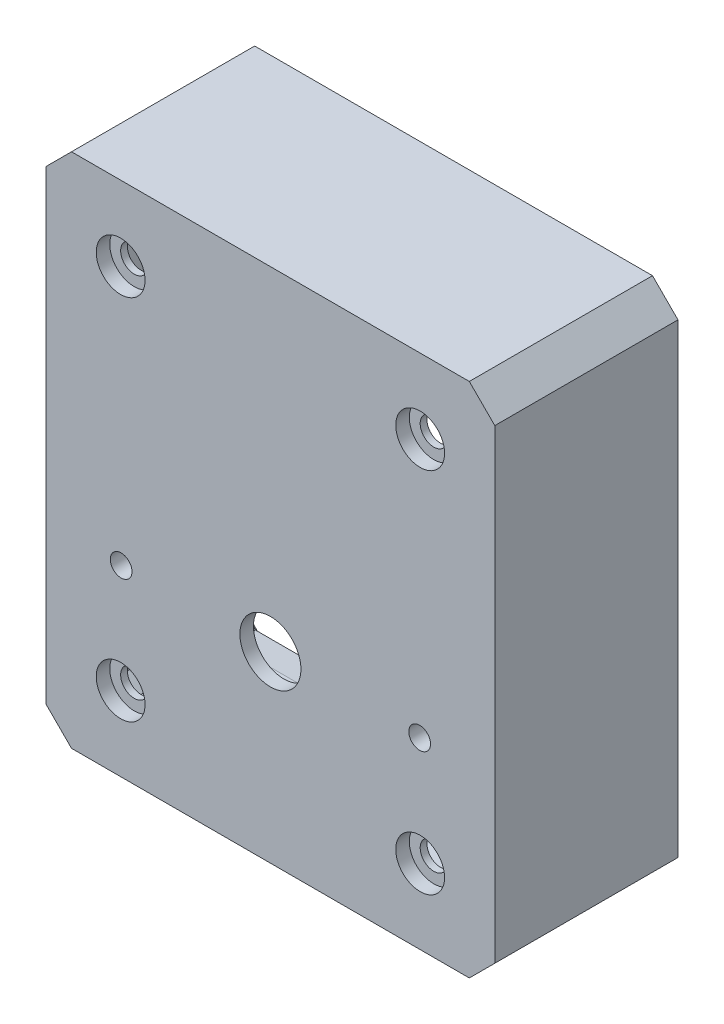
from build123d import *
from OCP.BRepFilletAPI import BRepFilletAPI_MakeChamfer

# Parameters (mm, degrees)
SKIZZE1_W                       = 60.15
SKIZZE1_H                       = 70.15
GRUNDK_RPER_DEPTH               = 24
FASE1_SIZE                      = 2
WANDUNG1_T                      = 3
SKIZZE2_R                       = 4.5
DURCHBRUCH_SERVO_DEPTH          = 101.338651576
SKIZZE4_W                       = 22
SKIZZE4_H                       = 42
SERVOFREISCHNITT_DEPTH          = 1
SCHNITT_LINEAR_AUSTRAGEN2_REACH = 102.339
SKIZZE7_R                       = 2
SKIZZE8_R                       = 3.6
SCHNITT_LINEAR_AUSTRAGEN3_DEPTH = 2
SCHNITT_LINEAR_AUSTRAGEN5_REACH = 102.339
SKIZZE3_R                       = 1.6
FASE2_SIZE                      = 5
FASE2_SIZE2                     = 0.437443318
FASE3_SIZE                      = 1
FASE3_SIZE2                     = 1.100062868


with BuildPart() as part:
    # Skizze1 → Grundkörper (new body)
    with BuildSketch(Plane.XY):
        with Locations((30.075, 35.075)):
            Rectangle(SKIZZE1_W, SKIZZE1_H)
    extrude(amount=GRUNDK_RPER_DEPTH)

    # Fase1
    fase1_edges = [part.edges().sort_by_distance(p)[0] for p in [
        (0, 70.15, 12),
        (60.15, 70.15, 12),
        (60.15, 0, 12),
        (0, 0, 12),
    ]]
    chamfer(fase1_edges, length=FASE1_SIZE)

    # Wandung1
    wandung1_openings = [part.faces().sort_by_distance(p)[0] for p in [
        (30.075, 35.075, 0),
    ]]
    offset(amount=WANDUNG1_T, openings=wandung1_openings, kind=Kind.INTERSECTION)

    # Skizze2 → Durchbruch Servo (cut, through all)
    with BuildSketch(Plane.XY.offset(27)):
        with Locations((30.075, 24)):
            Circle(SKIZZE2_R)
    extrude(amount=-DURCHBRUCH_SERVO_DEPTH, mode=Mode.SUBTRACT)

    # Skizze4 → ServoFreischnitt (cut)
    with BuildSketch(Plane(origin=(0, 0, 24), x_dir=(-1, 0, 0), z_dir=(0, 0, -1))):
        with Locations((-30.075, 35)):
            Rectangle(SKIZZE4_W, SKIZZE4_H)
    extrude(amount=-SERVOFREISCHNITT_DEPTH, mode=Mode.SUBTRACT)

    # Skizze7 → Schnitt-Linear austragen2 (cut, up to next)
    with BuildSketch(Plane.XY.offset(27), mode=Mode.PRIVATE) as schnitt_linear_austragen2_sk1:
        with Locations((8, 62.15)):
            Circle(SKIZZE7_R)
    schnitt_linear_austragen2_tool1 = extrude(schnitt_linear_austragen2_sk1.sketch, amount=-SCHNITT_LINEAR_AUSTRAGEN2_REACH, mode=Mode.PRIVATE) & part.part
    # Skizze7 → Schnitt-Linear austragen2 (cut, up to next)
    with BuildSketch(Plane.XY.offset(27), mode=Mode.PRIVATE) as schnitt_linear_austragen2_sk2:
        with Locations(Location((52.15, 62.15, 0), (0, 0, 180))):
            Circle(SKIZZE7_R)
    schnitt_linear_austragen2_tool2 = extrude(schnitt_linear_austragen2_sk2.sketch, amount=-SCHNITT_LINEAR_AUSTRAGEN2_REACH, mode=Mode.PRIVATE) & part.part
    # Skizze7 → Schnitt-Linear austragen2 (cut, up to next)
    with BuildSketch(Plane.XY.offset(27), mode=Mode.PRIVATE) as schnitt_linear_austragen2_sk3:
        with Locations((52.15, 8)):
            Circle(SKIZZE7_R)
    schnitt_linear_austragen2_tool3 = extrude(schnitt_linear_austragen2_sk3.sketch, amount=-SCHNITT_LINEAR_AUSTRAGEN2_REACH, mode=Mode.PRIVATE) & part.part
    # Skizze7 → Schnitt-Linear austragen2 (cut, up to next)
    with BuildSketch(Plane.XY.offset(27), mode=Mode.PRIVATE) as schnitt_linear_austragen2_sk4:
        with Locations(Location((8, 8, 0), (0, 0, 180))):
            Circle(SKIZZE7_R)
    schnitt_linear_austragen2_tool4 = extrude(schnitt_linear_austragen2_sk4.sketch, amount=-SCHNITT_LINEAR_AUSTRAGEN2_REACH, mode=Mode.PRIVATE) & part.part
    add(schnitt_linear_austragen2_tool1.solids().sort_by_distance((8, 62.15, 27))[0], mode=Mode.SUBTRACT)
    add(schnitt_linear_austragen2_tool2.solids().sort_by_distance((52.15, 62.15, 27))[0], mode=Mode.SUBTRACT)
    add(schnitt_linear_austragen2_tool3.solids().sort_by_distance((52.15, 8, 27))[0], mode=Mode.SUBTRACT)
    add(schnitt_linear_austragen2_tool4.solids().sort_by_distance((8, 8, 27))[0], mode=Mode.SUBTRACT)

    # Skizze8 → Schnitt-Linear austragen3 (cut)
    with BuildSketch(Plane.XY.offset(27)):
        with Locations((8, 62.15)):
            Circle(SKIZZE8_R)
        with Locations((52.15, 62.15)):
            Circle(SKIZZE8_R)
        with Locations((52.15, 8)):
            Circle(SKIZZE8_R)
        with Locations((8, 8)):
            Circle(SKIZZE8_R)
    extrude(amount=-SCHNITT_LINEAR_AUSTRAGEN3_DEPTH, mode=Mode.SUBTRACT)

    # Skizze3 → Schnitt-Linear austragen5 (cut, up to next)
    with BuildSketch(Plane.XY.offset(27), mode=Mode.PRIVATE) as schnitt_linear_austragen5_sk1:
        with Locations((8.075, 24)):
            Circle(SKIZZE3_R)
    schnitt_linear_austragen5_tool1 = extrude(schnitt_linear_austragen5_sk1.sketch, amount=-SCHNITT_LINEAR_AUSTRAGEN5_REACH, mode=Mode.PRIVATE) & part.part
    # Skizze3 → Schnitt-Linear austragen5 (cut, up to next)
    with BuildSketch(Plane.XY.offset(27), mode=Mode.PRIVATE) as schnitt_linear_austragen5_sk2:
        with Locations((52.075, 24)):
            Circle(SKIZZE3_R)
    schnitt_linear_austragen5_tool2 = extrude(schnitt_linear_austragen5_sk2.sketch, amount=-SCHNITT_LINEAR_AUSTRAGEN5_REACH, mode=Mode.PRIVATE) & part.part
    add(schnitt_linear_austragen5_tool1.solids().sort_by_distance((8.075, 24, 27))[0], mode=Mode.SUBTRACT)
    add(schnitt_linear_austragen5_tool2.solids().sort_by_distance((52.075, 24, 27))[0], mode=Mode.SUBTRACT)

    # Fase2: one chamfer whose edges measure the first distance from different faces: ONE call of the kernel's chamfer builder (chamfer() names one face for all edges)
    fase2_edges_1 = [part.edges().sort_by_distance(p)[0] for p in [
        (0, 35.075, 0),
    ]]
    fase2_side_1 = [part.faces().sort_by_distance(p)[0] for p in [
        (0, 35.075, 12),
    ]]
    fase2_edges_2 = [part.edges().sort_by_distance(p)[0] for p in [
        (30.075, 0, 0),
    ]]
    fase2_side_2 = [part.faces().sort_by_distance(p)[0] for p in [
        (30.075, 0, 12),
    ]]
    fase2_edges_3 = [part.edges().sort_by_distance(p)[0] for p in [
        (60.15, 35.075, 0),
    ]]
    fase2_side_3 = [part.faces().sort_by_distance(p)[0] for p in [
        (60.15, 35.075, 12),
    ]]
    fase2_edges_4 = [part.edges().sort_by_distance(p)[0] for p in [
        (30.075, 70.15, 0),
    ]]
    fase2_side_4 = [part.faces().sort_by_distance(p)[0] for p in [
        (30.075, 70.15, 12),
    ]]
    fase2_edges_5 = [part.edges().sort_by_distance(p)[0] for p in [
        (59.15, 1, 0),
    ]]
    fase2_side_5 = [part.faces().sort_by_distance(p)[0] for p in [
        (59.15, 1, 12),
    ]]
    fase2_edges_6 = [part.edges().sort_by_distance(p)[0] for p in [
        (1, 1, 0),
    ]]
    fase2_side_6 = [part.faces().sort_by_distance(p)[0] for p in [
        (1, 1, 12),
    ]]
    fase2_edges_7 = [part.edges().sort_by_distance(p)[0] for p in [
        (1, 69.15, 0),
    ]]
    fase2_side_7 = [part.faces().sort_by_distance(p)[0] for p in [
        (1, 69.15, 12),
    ]]
    fase2_edges_8 = [part.edges().sort_by_distance(p)[0] for p in [
        (59.15, 69.15, 0),
    ]]
    fase2_side_8 = [part.faces().sort_by_distance(p)[0] for p in [
        (59.15, 69.15, 12),
    ]]
    fase2 = BRepFilletAPI_MakeChamfer(part.part.solid().wrapped)
    for e in fase2_edges_1:
        fase2.Add(FASE2_SIZE, FASE2_SIZE2, e.wrapped, fase2_side_1[0].wrapped)  # the first distance lies on this face
    for e in fase2_edges_2:
        fase2.Add(FASE2_SIZE, FASE2_SIZE2, e.wrapped, fase2_side_2[0].wrapped)  # the first distance lies on this face
    for e in fase2_edges_3:
        fase2.Add(FASE2_SIZE, FASE2_SIZE2, e.wrapped, fase2_side_3[0].wrapped)  # the first distance lies on this face
    for e in fase2_edges_4:
        fase2.Add(FASE2_SIZE, FASE2_SIZE2, e.wrapped, fase2_side_4[0].wrapped)  # the first distance lies on this face
    for e in fase2_edges_5:
        fase2.Add(FASE2_SIZE, FASE2_SIZE2, e.wrapped, fase2_side_5[0].wrapped)  # the first distance lies on this face
    for e in fase2_edges_6:
        fase2.Add(FASE2_SIZE, FASE2_SIZE2, e.wrapped, fase2_side_6[0].wrapped)  # the first distance lies on this face
    for e in fase2_edges_7:
        fase2.Add(FASE2_SIZE, FASE2_SIZE2, e.wrapped, fase2_side_7[0].wrapped)  # the first distance lies on this face
    for e in fase2_edges_8:
        fase2.Add(FASE2_SIZE, FASE2_SIZE2, e.wrapped, fase2_side_8[0].wrapped)  # the first distance lies on this face
    add(Compound.cast(fase2.Shape()), mode=Mode.REPLACE)

    # Fase3: one chamfer whose edges measure the first distance from different faces: ONE call of the kernel's chamfer builder (chamfer() names one face for all edges)
    fase3_edges_1 = [part.edges().sort_by_distance(p)[0] for p in [
        (60.587443318, 35.075, 0),
    ]]
    fase3_side_1 = [part.faces().sort_by_distance(p)[0] for p in [
        (60.368920817, 35.075, 2.497723608),
    ]]
    fase3_edges_2 = [part.edges().sort_by_distance(p)[0] for p in [
        (59.459319136, 69.459319136, 0),
    ]]
    fase3_side_2 = [part.faces().sort_by_distance(p)[0] for p in [
        (59.307763339, 69.307763339, 2.449828985),
    ]]
    fase3_edges_3 = [part.edges().sort_by_distance(p)[0] for p in [
        (30.075, 70.587443318, 0),
    ]]
    fase3_side_3 = [part.faces().sort_by_distance(p)[0] for p in [
        (30.075, 70.368956172, 2.4973195),
    ]]
    fase3_edges_4 = [part.edges().sort_by_distance(p)[0] for p in [
        (0.690680864, 69.459319136, 0),
    ]]
    fase3_side_4 = [part.faces().sort_by_distance(p)[0] for p in [
        (0.842236661, 69.307763339, 2.449828985),
    ]]
    fase3_edges_5 = [part.edges().sort_by_distance(p)[0] for p in [
        (-0.437443318, 35.075, 0),
    ]]
    fase3_side_5 = [part.faces().sort_by_distance(p)[0] for p in [
        (-0.218920817, 35.075, 2.497723608),
    ]]
    fase3_edges_6 = [part.edges().sort_by_distance(p)[0] for p in [
        (0.690680864, 0.690680864, 0),
    ]]
    fase3_side_6 = [part.faces().sort_by_distance(p)[0] for p in [
        (0.842236661, 0.842236661, 2.449828985),
    ]]
    fase3_edges_7 = [part.edges().sort_by_distance(p)[0] for p in [
        (30.075, -0.437443318, 0),
    ]]
    fase3_side_7 = [part.faces().sort_by_distance(p)[0] for p in [
        (30.075, -0.218956172, 2.4973195),
    ]]
    fase3_edges_8 = [part.edges().sort_by_distance(p)[0] for p in [
        (59.459319136, 0.690680864, 0),
    ]]
    fase3_side_8 = [part.faces().sort_by_distance(p)[0] for p in [
        (59.307763339, 0.842236661, 2.449828985),
    ]]
    fase3 = BRepFilletAPI_MakeChamfer(part.part.solid().wrapped)
    for e in fase3_edges_1:
        fase3.Add(FASE3_SIZE, FASE3_SIZE2, e.wrapped, fase3_side_1[0].wrapped)  # the first distance lies on this face
    for e in fase3_edges_2:
        fase3.Add(FASE3_SIZE, FASE3_SIZE2, e.wrapped, fase3_side_2[0].wrapped)  # the first distance lies on this face
    for e in fase3_edges_3:
        fase3.Add(FASE3_SIZE, FASE3_SIZE2, e.wrapped, fase3_side_3[0].wrapped)  # the first distance lies on this face
    for e in fase3_edges_4:
        fase3.Add(FASE3_SIZE, FASE3_SIZE2, e.wrapped, fase3_side_4[0].wrapped)  # the first distance lies on this face
    for e in fase3_edges_5:
        fase3.Add(FASE3_SIZE, FASE3_SIZE2, e.wrapped, fase3_side_5[0].wrapped)  # the first distance lies on this face
    for e in fase3_edges_6:
        fase3.Add(FASE3_SIZE, FASE3_SIZE2, e.wrapped, fase3_side_6[0].wrapped)  # the first distance lies on this face
    for e in fase3_edges_7:
        fase3.Add(FASE3_SIZE, FASE3_SIZE2, e.wrapped, fase3_side_7[0].wrapped)  # the first distance lies on this face
    for e in fase3_edges_8:
        fase3.Add(FASE3_SIZE, FASE3_SIZE2, e.wrapped, fase3_side_8[0].wrapped)  # the first distance lies on this face
    add(Compound.cast(fase3.Shape()), mode=Mode.REPLACE)


solid = part.part
